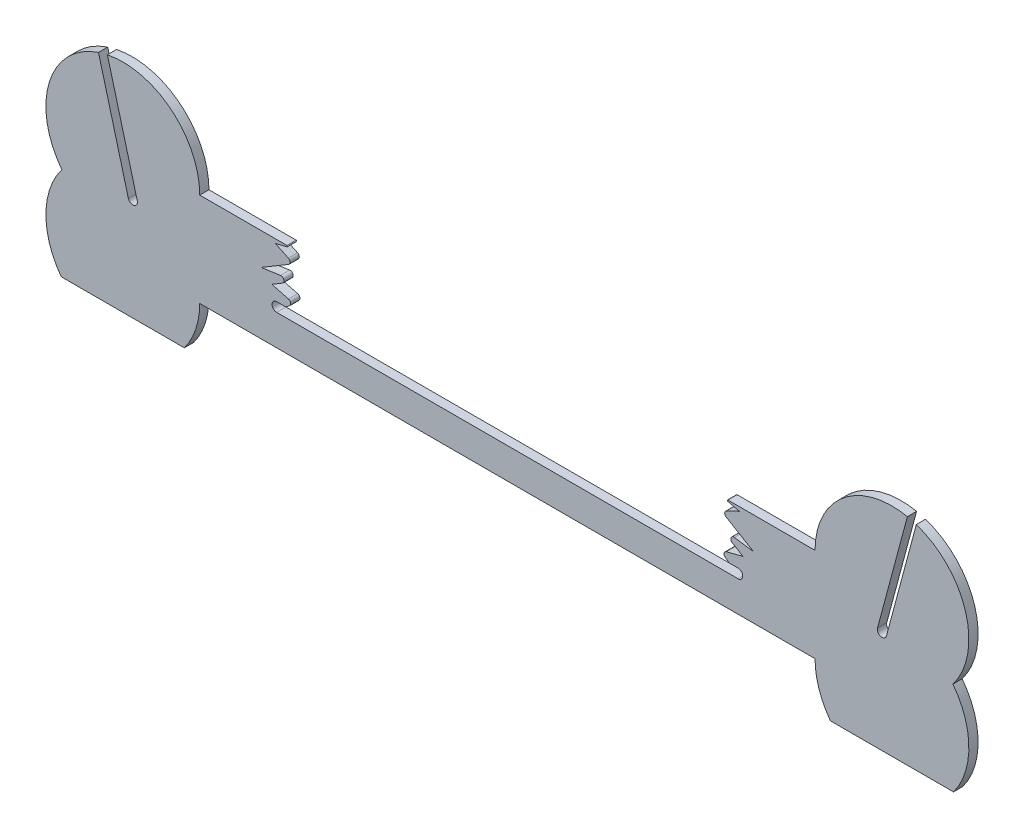
from build123d import *
from OCP.BRepFilletAPI import BRepFilletAPI_MakeFillet

# Parameters (mm, degrees)
RESSALTO_EXTRUS_O2_DEPTH = 6
FILETE2_R1               = 2
FILETE2_R2               = 0.4
FILETE3_R                = 0.4
FILETE4_R                = 2


with BuildPart() as part:
    # Esboço1 → Ressalto-extrusão2 (new body)
    with BuildSketch(Plane.XY):
        with BuildLine():
            Line((-199.999999999, 0), (199.999999999, 0))
            ThreePointArc((199.999999999, 0), (202.565835097, -15.811388301), (209.999999999, -30))
            Line((209.999999999, -30), (289.999999999, -30))
            ThreePointArc((289.999999999, -30), (299.999014124, 0.31398499), (289.62007067, 30.5))
            ThreePointArc((289.62007067, 30.5), (297.818976076, 75.60635228), (265.815415017, 108.432822474))
            Line((265.815415017, 108.432822474), (246.403986634, 35.988385502))
            ThreePointArc((246.403986634, 35.988385502), (242.72975202, 33.867065158), (240.608431676, 37.541299773))
            Line((240.608431676, 37.541299773), (260.019860059, 109.985736744))
            ThreePointArc((260.019860059, 109.985736744), (218.38507475, 99.736242739), (199.999999999, 61))
            Line((199.999999999, 61), (140, 61))
            Line((140, 61), (150.784643454, 58.387579086))
            Line((150.784643454, 58.387579086), (139.047219324, 52.742194858))
            Line((139.047219324, 52.742194858), (160.085396074, 40.245061921))
            Line((160.085396074, 40.245061921), (137.597498913, 43.437533109))
            Line((137.597498913, 43.437533109), (153.154101004, 34.194272541))
            Line((153.154101004, 34.194272541), (138.26257587, 30.30469508))
            Line((138.26257587, 30.30469508), (144.152507453, 26))
            Line((144.152507453, 26), (149.999999999, 26))
            ThreePointArc((149.999999999, 26), (152.999999999, 23), (149.999999999, 20))
            Line((149.999999999, 20), (-149.999999999, 20))
            ThreePointArc((-149.999999999, 20), (-152.999999999, 23), (-149.999999999, 26))
            Line((-149.999999999, 26), (-144.152507453, 26))
            Line((-144.152507453, 26), (-138.26257587, 30.30469508))
            Line((-138.26257587, 30.30469508), (-153.154101004, 34.194272541))
            Line((-153.154101004, 34.194272541), (-137.597498913, 43.437533109))
            Line((-137.597498913, 43.437533109), (-160.085396074, 40.245061921))
            Line((-160.085396074, 40.245061921), (-139.047219324, 52.742194858))
            Line((-139.047219324, 52.742194858), (-150.784643454, 58.387579086))
            Line((-150.784643454, 58.387579086), (-140, 61))
            Line((-140, 61), (-199.999999999, 61))
            ThreePointArc((-199.999999999, 61), (-218.38507475, 99.736242739), (-260.019860059, 109.985736744))
            Line((-260.019860059, 109.985736744), (-240.608431676, 37.541299773))
            ThreePointArc((-240.608431676, 37.541299773), (-242.72975202, 33.867065158), (-246.403986634, 35.988385502))
            Line((-246.403986634, 35.988385502), (-265.815415017, 108.432822474))
            ThreePointArc((-265.815415017, 108.432822474), (-297.818976076, 75.60635228), (-289.62007067, 30.5))
            ThreePointArc((-289.62007067, 30.5), (-299.999014124, 0.31398499), (-289.999999999, -30))
            Line((-289.999999999, -30), (-209.999999999, -30))
            ThreePointArc((-209.999999999, -30), (-202.565835097, -15.811388301), (-199.999999999, 0))
        make_face()
    extrude(amount=RESSALTO_EXTRUS_O2_DEPTH)

    # Filete2: one fillet with a radius per group of edges: ONE call of the kernel's fillet builder (fillet() takes one radius for all edges)
    filete2_edges_1 = [part.edges().sort_by_distance(p)[0] for p in [
        (139.047219324, 52.742194858, 3),
        (137.597498913, 43.437533109, 3),
        (138.26257587, 30.30469508, 3),
    ]]
    filete2_edges_2 = [part.edges().sort_by_distance(p)[0] for p in [
        (140, 61, 3),
    ]]
    filete2 = BRepFilletAPI_MakeFillet(part.part.solid().wrapped)
    for e in filete2_edges_1:
        filete2.Add(FILETE2_R1, e.wrapped)
    for e in filete2_edges_2:
        filete2.Add(FILETE2_R2, e.wrapped)
    add(Compound.cast(filete2.Shape()), mode=Mode.REPLACE)

    # Filete3
    filete3_edges = [part.edges().sort_by_distance(p)[0] for p in [
        (-140, 61, 3),
    ]]
    fillet(filete3_edges, radius=FILETE3_R)

    # Filete4
    filete4_edges = [part.edges().sort_by_distance(p)[0] for p in [
        (-138.26257587, 30.30469508, 3),
        (-137.597498913, 43.437533109, 3),
        (-139.047219324, 52.742194858, 3),
    ]]
    fillet(filete4_edges, radius=FILETE4_R)


solid = part.part
